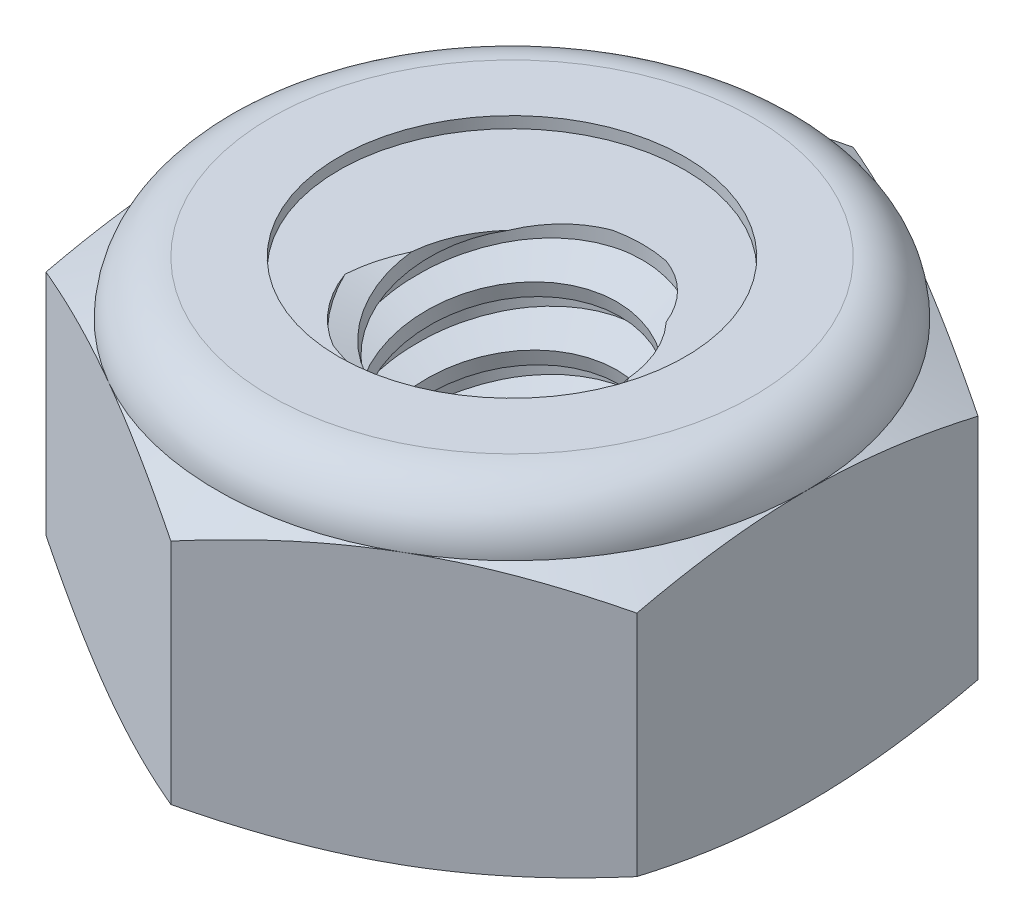
from build123d import *

# Parameters (mm, degrees)
EXTRUDE1_DEPTH       = 4.365625
SKETCH2_W            = 1.7526
SKETCH2_H            = 4.365625
LPATTERN1_COUNT      = 6
LPATTERN1_PITCH      = 0.79375
LPATTERN1_COUNT_DIR2 = 2
LPATTERN1_PITCH_DIR2 = 0.79375


with BuildPart() as part:
    # Sketch1 → Extrude1 (new body)
    with BuildSketch(Plane(origin=(0, 0, 0), x_dir=(1, 0, 0), z_dir=(0, 1, 0))):
        Polygon((0, 4.582717762), (-3.96875, 2.291358881), (-3.96875, -2.291358881), (0, -4.582717762), (3.96875, -2.291358881), (3.96875, 2.291358881), align=None)
    extrude(amount=EXTRUDE1_DEPTH)


with BuildPart() as body_2:
    # Sketch2 → Revolve1 (revolve)
    with BuildSketch(Plane(origin=(0, 0, 0), x_dir=(0, 0, -1), z_dir=(1, 0, 0))):
        with Locations((0.8763, 2.1828125)):
            Rectangle(SKETCH2_W, SKETCH2_H)
    revolve(axis=Axis((0, -1.7526, 0), (0, 1, 0)))

    # Sketch3 → Cut-Revolve1 (revolve, cut)
    with BuildSketch(Plane(origin=(0, 0, 0), x_dir=(0, 0, -1), z_dir=(1, 0, 0))):
        Polygon((1.774513192, 4.268856346), (1.927905533, 3.591475768), (1.454101991, 3.7385105), (1.410275607, 3.932047808), align=None)
    cut_revolve1 = revolve(axis=Axis((0, 4.365625, 0.193538035), (0, -0.9753061185369931, -0.22085736379913792)), mode=Mode.SUBTRACT)

    # LPattern1: Cut-Revolve1 6 × 2
    with Locations(*[Vector(0, -1, 0) * (i * LPATTERN1_PITCH) + Vector(0, 1, 0) * (j * LPATTERN1_PITCH_DIR2) for i in range(LPATTERN1_COUNT) for j in range(LPATTERN1_COUNT_DIR2) if (i, j) != (0, 0)]):
        add(cut_revolve1, mode=Mode.SUBTRACT)


with BuildPart() as part_1:
    add(part.part)

    # Combine1: cut body 2
    add(body_2.part, mode=Mode.SUBTRACT)

    # Sketch5 → Cut-Revolve3 (revolve, cut)
    with BuildSketch(Plane(origin=(0, 0, 0), x_dir=(0, 0, -1), z_dir=(1, 0, 0))):
        with BuildLine():
            Line((0, 0), (3.96875, 0))
            Line((3.96875, 0), (4.582717762, 0.286297869))
            Line((4.582717762, 0.286297869), (4.582717762, 3.351722964))
            Line((4.582717762, 3.351722964), (3.96875, 3.638020833))
            ThreePointArc((3.96875, 3.638020833), (3.755639674, 4.152514674), (3.241145833, 4.365625))
            Line((3.241145833, 4.365625), (3.241145833, 5.635625))
            Line((3.241145833, 5.635625), (5.852717762, 5.635625))
            Line((5.852717762, 5.635625), (5.852717762, -1.27))
            Line((5.852717762, -1.27), (0, -1.27))
            Line((0, -1.27), (0, 0))
        make_face()
    revolve(axis=Axis((0, 0, 0), (0, 1, 0)), mode=Mode.SUBTRACT)

    # Sketch6 → Cut-Revolve4 (revolve, cut)
    with BuildSketch(Plane(origin=(0, 0, 0), x_dir=(0, 0, -1), z_dir=(1, 0, 0))):
        with BuildLine():
            Line((0, 3.638020833), (3.81635, 3.638020833))
            ThreePointArc((3.81635, 3.638020833), (3.6478766, 4.0447516), (3.241145833, 4.213225))
            Line((3.241145833, 4.213225), (2.32571072, 4.213225))
            Line((2.32571072, 4.213225), (2.32571072, 5.635625))
            Line((2.32571072, 5.635625), (0, 5.635625))
            Line((0, 5.635625), (0, 3.638020833))
        make_face()
    revolve(axis=Axis((0, 5.635625, 0), (0, 1, 0)), mode=Mode.SUBTRACT)


solid = part_1.part
